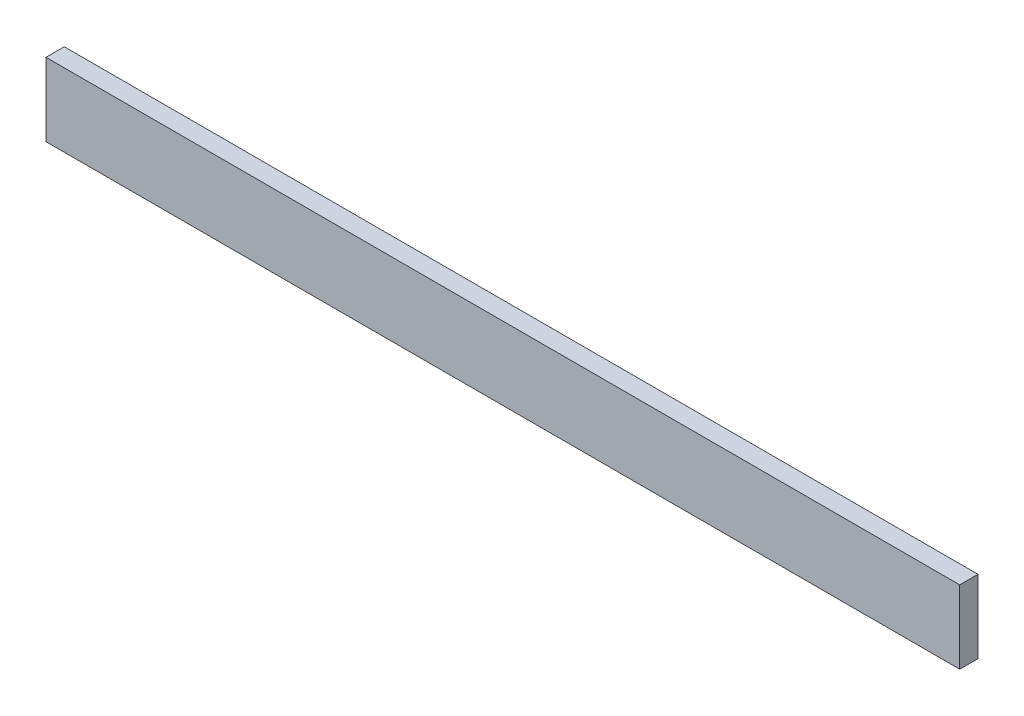
from build123d import *

# Parameters (mm, degrees)
SKETCH1_W           = 250
SKETCH1_H           = 20
BOSS_EXTRUDE1_DEPTH = 5


with BuildPart() as part:
    # Sketch1 → Boss-Extrude1 (new body)
    with BuildSketch(Plane.XY):
        with Locations((125, 10)):
            Rectangle(SKETCH1_W, SKETCH1_H)
    extrude(amount=BOSS_EXTRUDE1_DEPTH)


solid = part.part
